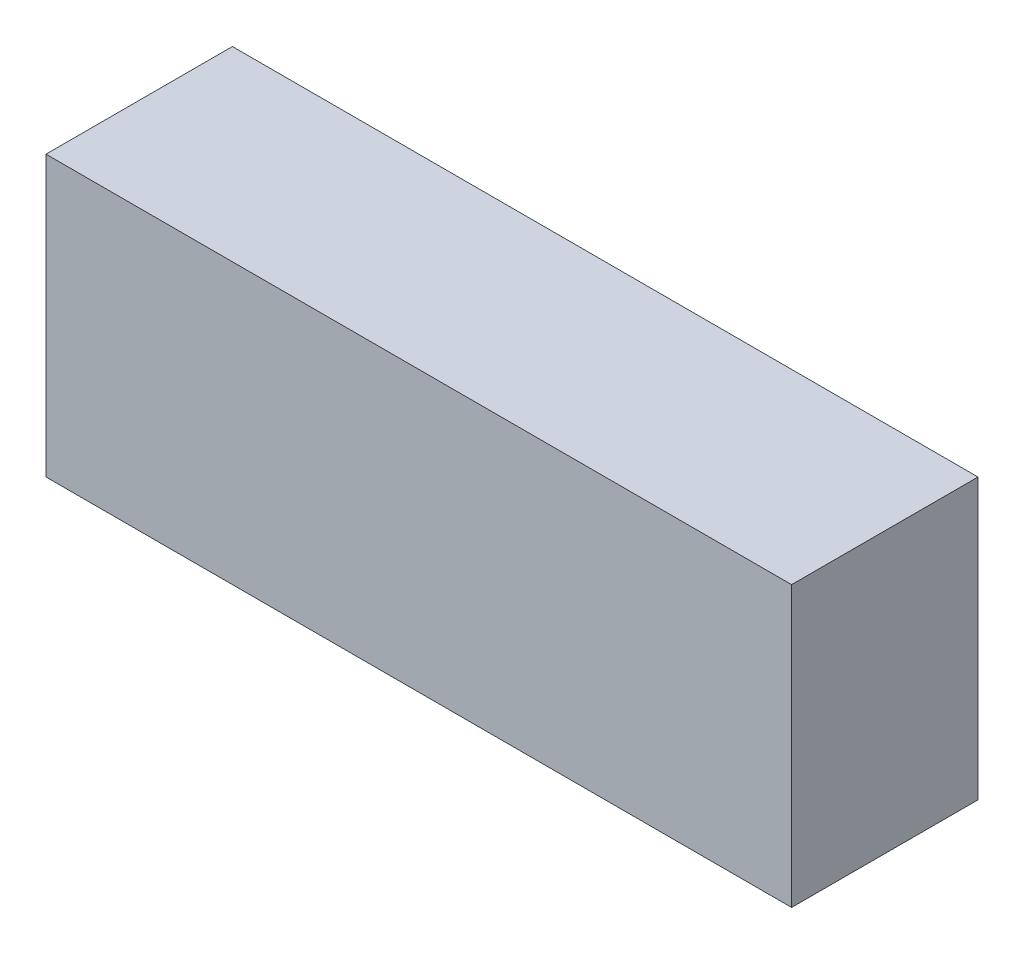
from build123d import *

# Parameters (mm, degrees)
SKETCH1_W           = 20.32
SKETCH1_H           = 7.62
BOSS_EXTRUDE1_DEPTH = 5.08


with BuildPart() as part:
    # Sketch1 → Boss-Extrude1 (new body)
    with BuildSketch(Plane.XY):
        with Locations((10.16, 3.81)):
            Rectangle(SKETCH1_W, SKETCH1_H)
    extrude(amount=BOSS_EXTRUDE1_DEPTH)


solid = part.part
